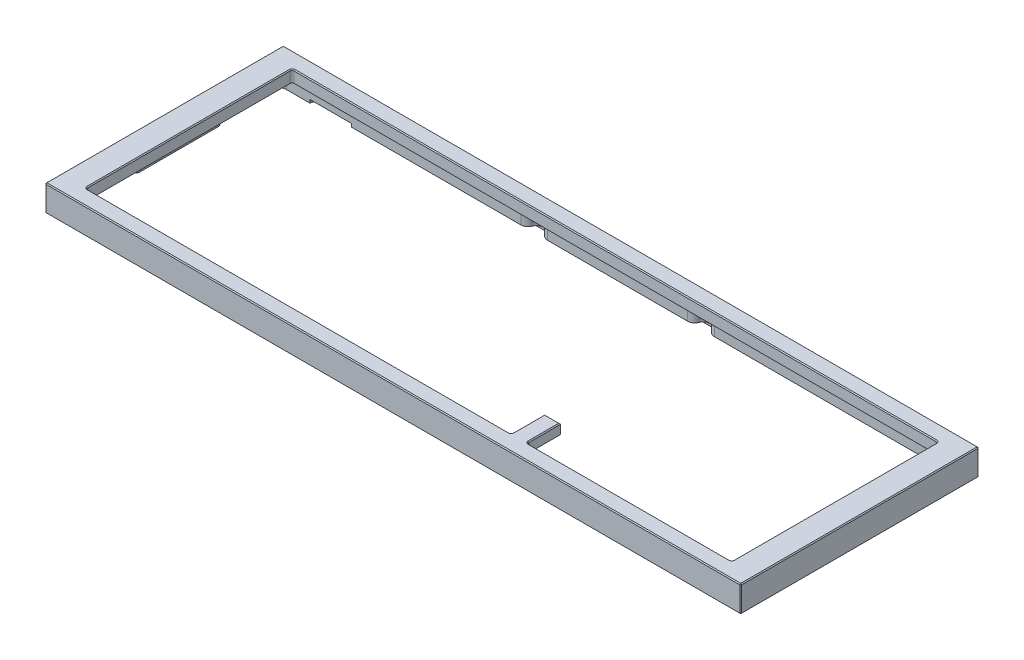
from build123d import *

# Parameters (mm, degrees)
SKETCH1_W                 = 390.8
SKETCH1_H                 = 133.8
BOSS_EXTRUDE1_DEPTH       = 13.1
CUT_EXTRUDE1_DEPTH        = 414.277981509
SKETCH3_W                 = 380.2
SKETCH3_H                 = 128.6
CUT_EXTRUDE2_DEPTH        = 6.6
SKETCH5_R                 = 2.5
SKETCH5_W                 = 5
SKETCH5_H                 = 3
BOSS_EXTRUDE2_DEPTH       = 6.6
SKETCH8_W                 = 8.9
SKETCH8_H                 = 18.85
CUT_EXTRUDE3_DEPTH        = 1
M2X0_4_TAPPED_HOLE2_D     = 1.6
M2X0_4_TAPPED_HOLE2_DEPTH = 4
M2X0_4_TAPPED_HOLE2_TIP   = 0.480688495
FILLET1_R                 = 4
FILLET2_R                 = 1.1
SKETCH14_W                = 390.8
SKETCH14_H                = 133.8
SKETCH14_W_2              = 386.8
SKETCH14_H_2              = 129.8
BOSS_EXTRUDE3_DEPTH       = 1.7
BOSS_EXTRUDE4_DEPTH       = 6.6
SKETCH17_R                = 3
CUT_EXTRUDE5_DEPTH        = 6.6
SKETCH18_W                = 12
SKETCH18_H                = 3.5
CUT_EXTRUDE6_DEPTH        = 10
FILLET4_R                 = 4
M2X0_4_TAPPED_HOLE3_D     = 1.6
M2X0_4_TAPPED_HOLE3_DEPTH = 4
M2X0_4_TAPPED_HOLE3_TIP   = 0.480688495
FILLET5_R                 = 4
CUT_EXTRUDE7_DEPTH        = 1.8
CHAMFER1_SIZE             = 0.5


with BuildPart() as part:
    # Sketch1 → Boss-Extrude1 (new body)
    with BuildSketch(Plane(origin=(0, 0, 0), x_dir=(1, 0, 0), z_dir=(0, 1, 0))):
        with Locations((195.4, -66.9)):
            Rectangle(SKETCH1_W, SKETCH1_H)
    extrude(amount=BOSS_EXTRUDE1_DEPTH)

    # Sketch2 → Cut-Extrude1 (cut, through all)
    with BuildSketch(Plane(origin=(0, 13.1, 0), x_dir=(1, 0, 0), z_dir=(0, 1, 0))):
        Polygon((376.8, -9), (14, -9), (14, -124.9), (252.9, -124.9), (252.9, -106.05), (261.8, -106.05), (261.8, -124.9), (376.8, -124.9), align=None)
    extrude(amount=-CUT_EXTRUDE1_DEPTH, mode=Mode.SUBTRACT)

    # Sketch3 → Cut-Extrude2 (cut)
    with BuildSketch(Plane.XZ):
        with Locations((195.4, 66.9)):
            Rectangle(SKETCH3_W, SKETCH3_H)
    extrude(amount=-CUT_EXTRUDE2_DEPTH, mode=Mode.SUBTRACT)

    # Sketch5 → Boss-Extrude2 (add)
    with BuildSketch(Plane.XZ.offset(-6.6)):
        with BuildLine():
            Line((382.5, 88.8), (382.5, 45))
            ThreePointArc((382.5, 45), (383.378679656, 47.121320344), (385.5, 48))
            Line((385.5, 48), (385.5, 85.8))
            ThreePointArc((385.5, 85.8), (383.378679656, 86.678679656), (382.5, 88.8))
        make_face()
        with BuildLine():
            ThreePointArc((382.5, 45), (383.378679656, 42.878679656), (385.5, 42))
            Line((385.5, 42), (385.5, 48))
            ThreePointArc((385.5, 48), (383.378679656, 47.121320344), (382.5, 45))
        make_face()
        with BuildLine():
            Line((385.5, 48), (385.5, 42))
            ThreePointArc((385.5, 42), (387.621320344, 42.878679656), (388.5, 45))
            ThreePointArc((388.5, 45), (387.621320344, 47.121320344), (385.5, 48))
        make_face()
        with BuildLine():
            ThreePointArc((385.5, 91.8), (383.378679656, 90.921320344), (382.5, 88.8))
            ThreePointArc((382.5, 88.8), (383.378679656, 86.678679656), (385.5, 85.8))
            Line((385.5, 85.8), (385.5, 91.8))
        make_face()
        with BuildLine():
            Line((385.5, 91.8), (385.5, 85.8))
            ThreePointArc((385.5, 85.8), (387.621320344, 86.678679656), (388.5, 88.8))
            ThreePointArc((388.5, 88.8), (387.621320344, 90.921320344), (385.5, 91.8))
        make_face()
        with BuildLine():
            ThreePointArc((290, 2.6), (287.5, 5.1), (285, 2.6))
            Line((285, 2.6), (290, 2.6))
        make_face()
        with BuildLine():
            Line((290, 2.6), (285, 2.6))
            ThreePointArc((285, 2.6), (287.5, 0.1), (290, 2.6))
        make_face()
        with BuildLine():
            ThreePointArc((197.9, 2.6), (195.4, 5.1), (192.9, 2.6))
            Line((192.9, 2.6), (197.9, 2.6))
        make_face()
        with BuildLine():
            Line((197.9, 2.6), (192.9, 2.6))
            ThreePointArc((192.9, 2.6), (195.4, 0.1), (197.9, 2.6))
        make_face()
        with BuildLine():
            ThreePointArc((105, 2.6), (102.5, 5.1), (100, 2.6))
            Line((100, 2.6), (105, 2.6))
        make_face()
        with BuildLine():
            Line((105, 2.6), (100, 2.6))
            ThreePointArc((100, 2.6), (102.5, 0.1), (105, 2.6))
        make_face()
        with BuildLine():
            ThreePointArc((5.3, 42), (7.421320344, 42.878679656), (8.3, 45))
            ThreePointArc((8.3, 45), (7.421320344, 47.121320344), (5.3, 48))
            Line((5.3, 48), (5.3, 42))
        make_face()
        with BuildLine():
            Line((5.3, 42), (5.3, 48))
            ThreePointArc((5.3, 48), (2.3, 45), (5.3, 42))
        make_face()
        with BuildLine():
            ThreePointArc((5.3, 48), (7.421320344, 47.121320344), (8.3, 45))
            Line((8.3, 45), (8.3, 88.8))
            ThreePointArc((8.3, 88.8), (7.421320344, 86.678679656), (5.3, 85.8))
            Line((5.3, 85.8), (5.3, 48))
        make_face()
        with BuildLine():
            ThreePointArc((5.3, 85.8), (7.421320344, 86.678679656), (8.3, 88.8))
            ThreePointArc((8.3, 88.8), (7.421320344, 90.921320344), (5.3, 91.8))
            Line((5.3, 91.8), (5.3, 85.8))
        make_face()
        with BuildLine():
            Line((5.3, 85.8), (5.3, 91.8))
            ThreePointArc((5.3, 91.8), (2.3, 88.8), (5.3, 85.8))
        make_face()
        with Locations((102.5, 128.2)):
            Circle(SKETCH5_R)
        with Locations((102.5, 129.7)):
            Rectangle(SKETCH5_W, SKETCH5_H)
        with Locations((287.5, 129.7)):
            Rectangle(SKETCH5_W, SKETCH5_H)
        with Locations((287.5, 128.2)):
            Circle(SKETCH5_R)
    extrude(amount=BOSS_EXTRUDE2_DEPTH)

    # Sketch8 → Cut-Extrude3 (cut)
    with BuildSketch(Plane.XZ.offset(-6.6)):
        with Locations((257.35, 115.475)):
            Rectangle(SKETCH8_W, SKETCH8_H)
    extrude(amount=-CUT_EXTRUDE3_DEPTH, mode=Mode.SUBTRACT)

    # M2x0.4 Tapped Hole2
    with Locations(Plane(origin=(382.9, 6.6, 22.7), x_dir=(0, 0, -1), z_dir=(0, -1, 0))):
        with Locations((0, 0), (-88.3, 0), (-106.3, -58.1), (-106.3, -190.7), (-106.3, -318.5), (0, -375), (-88.3, -375), (17.3, -140.6), (17.3, -234.3)):
            Hole(M2X0_4_TAPPED_HOLE2_D / 2, depth=M2X0_4_TAPPED_HOLE2_DEPTH)
            with Locations((0, 0, -(M2X0_4_TAPPED_HOLE2_DEPTH + M2X0_4_TAPPED_HOLE2_TIP / 2))):  # 118° drill point
                Cone(0, M2X0_4_TAPPED_HOLE2_D / 2, M2X0_4_TAPPED_HOLE2_TIP, mode=Mode.SUBTRACT)

    # Fillet1
    fillet1_edges = [part.edges().sort_by_distance(p)[0] for p in [
        (385.5, 3.3, 42),
        (385.5, 3.3, 2.6),
        (5.3, 3.3, 2.6),
        (5.3, 3.3, 42),
        (5.3, 3.3, 91.8),
        (5.3, 3.3, 131.2),
        (100, 3.3, 131.2),
        (105, 3.3, 131.2),
        (290, 3.3, 131.2),
        (285, 3.3, 131.2),
        (385.5, 3.3, 131.2),
        (385.5, 3.3, 91.8),
    ]]
    fillet(fillet1_edges, radius=FILLET1_R)

    # Fillet2
    fillet2_edges = [part.edges().sort_by_distance(p)[0] for p in [
        (105, 3.3, 2.6),
        (100, 3.3, 2.6),
        (252.9, 10.35, 124.9),
        (261.8, 10.35, 124.9),
        (376.8, 9.85, 124.9),
        (376.8, 9.85, 9),
        (14, 9.85, 9),
        (14, 9.85, 124.9),
        (290, 3.3, 2.6),
        (285, 3.3, 2.6),
        (197.9, 3.3, 2.6),
        (192.9, 3.3, 2.6),
    ]]
    fillet(fillet2_edges, radius=FILLET2_R)

    # Sketch14 → Boss-Extrude3 (add)
    with BuildSketch(Plane.XZ):
        with Locations((195.4, 66.9)):
            Rectangle(SKETCH14_W, SKETCH14_H)
        with Locations((195.4, 66.9)):
            Rectangle(SKETCH14_W_2, SKETCH14_H_2, mode=Mode.SUBTRACT)
    extrude(amount=BOSS_EXTRUDE3_DEPTH)

    # Sketch16 → Boss-Extrude4 (add)
    with BuildSketch(Plane.XZ.offset(-6.6)):
        with BuildLine():
            Line((243.5489996, 2.6), (385.5, 2.6))
            Line((385.5, 2.6), (385.5, 7.6))
            Line((385.5, 7.6), (246.3, 7.6))
            Line((246.3, 7.6), (246.3, 6.4))
            ThreePointArc((246.3, 6.4), (245.540061604, 4.054365587), (243.5489996, 2.6))
        make_face()
        with BuildLine():
            Line((149.8489996, 2.6), (241.0510004, 2.6))
            ThreePointArc((241.0510004, 2.6), (239.059938396, 4.054365587), (238.3, 6.4))
            Line((238.3, 6.4), (238.3, 7.6))
            Line((238.3, 7.6), (152.6, 7.6))
            Line((152.6, 7.6), (152.6, 6.4))
            ThreePointArc((152.6, 6.4), (151.840061604, 4.054365587), (149.8489996, 2.6))
        make_face()
        with BuildLine():
            Line((5.3, 2.6), (147.3510004, 2.6))
            ThreePointArc((147.3510004, 2.6), (145.359938396, 4.054365587), (144.6, 6.4))
            Line((144.6, 6.4), (144.6, 7.6))
            Line((144.6, 7.6), (5.3, 7.6))
            Line((5.3, 7.6), (5.3, 2.6))
        make_face()
    extrude(amount=BOSS_EXTRUDE4_DEPTH)

    # Sketch17 → Cut-Extrude5 (cut)
    with BuildSketch(Plane.XZ.offset(-6.6)):
        with Locations((148.6, 5.4)):
            Circle(SKETCH17_R)
        with Locations((242.3, 5.4)):
            Circle(SKETCH17_R)
    extrude(amount=CUT_EXTRUDE5_DEPTH, mode=Mode.SUBTRACT)

    # Sketch18 → Cut-Extrude6 (cut)
    with BuildSketch(Plane(origin=(0, 0, 0), x_dir=(-1, 0, 0), z_dir=(0, 0, -1))):
        with Locations((-34.3, 0.05)):
            Rectangle(SKETCH18_W, SKETCH18_H)
    extrude(amount=-CUT_EXTRUDE6_DEPTH, mode=Mode.SUBTRACT)

    # Fillet4
    fillet4_edges = [part.edges().sort_by_distance(p)[0] for p in [
        (144.6, 3.3, 7.6),
        (152.6, 3.3, 7.6),
        (238.3, 3.3, 7.6),
        (246.3, 3.3, 7.6),
    ]]
    fillet(fillet4_edges, radius=FILLET4_R)

    # M2x0.4 Tapped Hole3
    with Locations(Plane(origin=(385.5, 0, 45), x_dir=(0, 0, -1), z_dir=(0, -1, 0))):
        with Locations((0, 0), (-43.8, 0), (-83.2, -98), (-83.2, -283), (-43.8, -380.2), (0, -380.2), (40.7, -72.681472158), (40.7, -190.092604773), (40.7, -307.518527842)):
            Hole(M2X0_4_TAPPED_HOLE3_D / 2, depth=M2X0_4_TAPPED_HOLE3_DEPTH)
            with Locations((0, 0, -(M2X0_4_TAPPED_HOLE3_DEPTH + M2X0_4_TAPPED_HOLE3_TIP / 2))):  # 118° drill point
                Cone(0, M2X0_4_TAPPED_HOLE3_D / 2, M2X0_4_TAPPED_HOLE3_TIP, mode=Mode.SUBTRACT)

    # Fillet5
    fillet5_edges = [part.edges().sort_by_distance(p)[0] for p in [
        (388.8, -0.85, 131.8),
        (388.8, -0.85, 2),
        (2, -0.85, 2),
        (2, -0.85, 131.8),
        (385.5, 3.3, 7.6),
        (5.3, 3.3, 7.6),
    ]]
    fillet(fillet5_edges, radius=FILLET5_R)

    # Sketch20 → Cut-Extrude7 (cut)
    with BuildSketch(Plane.XZ):
        with BuildLine():
            ThreePointArc((45.9, 7.6), (36.340202025, 11.559797975), (40.3, 2))
            Line((40.3, 2), (40.3, 7.6))
            Line((40.3, 7.6), (45.9, 7.6))
        make_face()
        with BuildLine():
            Line((40.3, 7.6), (40.3, 2))
            ThreePointArc((40.3, 2), (44.259797975, 3.640202025), (45.9, 7.6))
            Line((45.9, 7.6), (40.3, 7.6))
        make_face()
        with BuildLine():
            ThreePointArc((22.7, 7.6), (24.340202025, 3.640202025), (28.3, 2))
            Line((28.3, 2), (28.3, 7.6))
            Line((28.3, 7.6), (22.7, 7.6))
        make_face()
        with BuildLine():
            Line((28.3, 7.6), (28.3, 2))
            ThreePointArc((28.3, 2), (32.259797975, 3.640202025), (33.9, 7.6))
            ThreePointArc((33.9, 7.6), (28.3, 13.2), (22.7, 7.6))
            Line((22.7, 7.6), (28.3, 7.6))
        make_face()
    extrude(amount=-CUT_EXTRUDE7_DEPTH, mode=Mode.SUBTRACT)

    # Chamfer1
    chamfer1_edges = [part.edges().sort_by_distance(p)[0] for p in [
        (390.8, 13.1, 66.9),
        (195.4, 13.1, 0),
        (257.35, 13.1, 106.05),
        (195.4, 13.1, 9),
        (376.8, 13.1, 66.95),
        (319.3, 13.1, 124.9),
        (133.45, 13.1, 124.9),
        (14, 13.1, 66.95),
        (261.8, 13.1, 114.925),
        (252.9, 13.1, 114.925),
        (376.477817459, 13.1, 9.322182541),
        (376.477817459, 13.1, 124.577817459),
        (14.322182541, 13.1, 124.577817459),
        (14.322182541, 13.1, 9.322182541),
        (262.122182541, 13.1, 124.577817459),
        (252.577817459, 13.1, 124.577817459),
        (0, 13.1, 66.9),
        (14.15, -1.7, 0),
        (390.8, -1.7, 66.9),
        (195.4, -1.7, 133.8),
        (0, -1.7, 66.9),
        (215.55, -1.7, 0),
        (0, 5.7, 0),
        (390.8, 5.7, 0),
        (390.8, 5.7, 133.8),
        (0, 5.7, 133.8),
        (195.4, 13.1, 133.8),
    ]]
    chamfer(chamfer1_edges, length=CHAMFER1_SIZE)


solid = part.part
